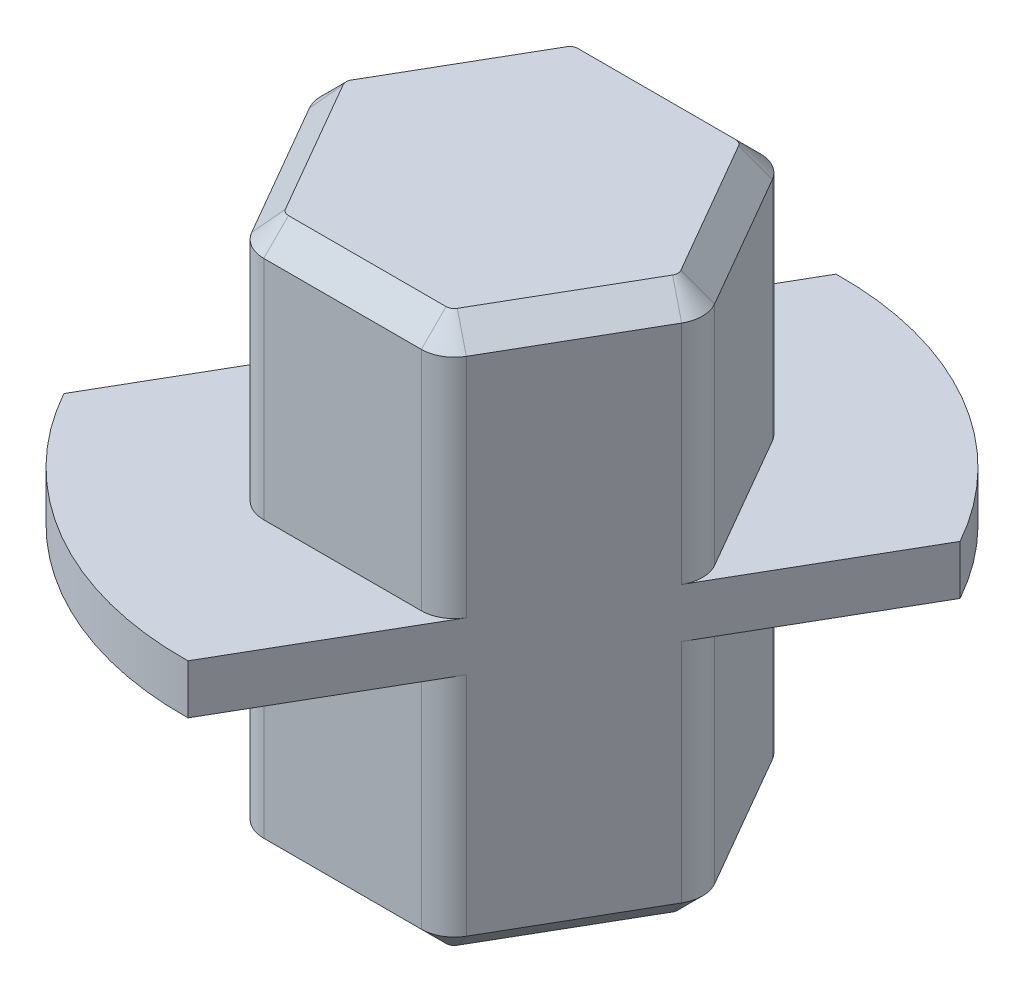
from build123d import *

# Parameters (mm, degrees)
BOSS_EXTRUDE1_DEPTH = 15.24
SKETCH2_R           = 20
BOSS_EXTRUDE2_DEPTH = 3
BOSS_EXTRUDE3_START = 18.24
BOSS_EXTRUDE3_DEPTH = 15.24
FILLET1_R           = 2
SKETCH3_W           = 35.8896148
SKETCH3_H           = 21.37412809
CUT_EXTRUDE1_DEPTH  = 51.878317112
CHAMFER2_SIZE       = 1.5
SKETCH5_W           = 51.439810339
SKETCH5_H           = 15.927026311
CUT_EXTRUDE3_DEPTH  = 50.49162642


with BuildPart() as part:
    # Sketch1 → Boss-Extrude1 (new body)
    with BuildSketch(Plane(origin=(0, 0, 0), x_dir=(1, 0, 0), z_dir=(0, 1, 0))):
        Polygon((5.9375, 10.28405167), (-5.9375, 10.28405167), (-11.875, 0), (-5.9375, -10.28405167), (5.9375, -10.28405167), (11.875, 0), align=None)
    extrude(amount=BOSS_EXTRUDE1_DEPTH)

    # Sketch2 → Boss-Extrude2 (add)
    with BuildSketch(Plane(origin=(0, 15.24, 0), x_dir=(1, 0, 0), z_dir=(0, 1, 0))):
        with Locations(Location((0, 0, 0), (0, 0, 270))):
            Circle(SKETCH2_R)
    extrude(amount=BOSS_EXTRUDE2_DEPTH)

    # Sketch1<2> → Boss-Extrude3 (add)
    with BuildSketch(Plane(origin=(0, 0, 0), x_dir=(1, 0, 0), z_dir=(0, 1, 0)).offset(BOSS_EXTRUDE3_START)):
        Polygon((5.9375, 10.28405167), (-5.9375, 10.28405167), (-11.875, 0), (-5.9375, -10.28405167), (5.9375, -10.28405167), (11.875, 0), align=None)
    extrude(amount=BOSS_EXTRUDE3_DEPTH)

    # Fillet1
    fillet1_edges = [part.edges().sort_by_distance(p)[0] for p in [
        (11.875, 7.62, 0),
        (5.9375, 7.62, 10.28405167),
        (-5.9375, 7.62, 10.28405167),
        (-11.875, 7.62, 0),
        (-5.9375, 7.62, -10.28405167),
        (5.9375, 7.62, -10.28405167),
        (-5.9375, 25.86, 10.28405167),
        (5.9375, 25.86, 10.28405167),
        (11.875, 25.86, 0),
        (5.9375, 25.86, -10.28405167),
        (-5.9375, 25.86, -10.28405167),
        (-11.875, 25.86, 0),
    ]]
    fillet(fillet1_edges, radius=FILLET1_R)

    # Sketch3 → Cut-Extrude1 (cut, through all)
    with BuildSketch(Plane(origin=(-8.90625, 0, -5.142025835), x_dir=(-0.5000000000000004, 0, 0.8660254037844385), z_dir=(-0.8660254037844384, 0, -0.5000000000000003))):
        with Locations((0.576480633, 22.756432149)):
            Rectangle(SKETCH3_W, SKETCH3_H)
    extrude(amount=CUT_EXTRUDE1_DEPTH, mode=Mode.SUBTRACT)

    # Chamfer2
    chamfer2_edges = [part.edges().sort_by_distance(p)[0] for p in [
        (0, 0, -10.28405167),
        (8.90625, 0, -5.142025835),
        (8.90625, 0, 5.142025835),
        (0, 0, 10.28405167),
        (-8.90625, 0, 5.142025835),
        (-8.90625, 0, -5.142025835),
        (11.565598923, 0, 0),
        (5.782799462, 0, 10.016102478),
        (-5.782799462, 0, 10.016102478),
        (-11.565598923, 0, 0),
        (-5.782799462, 0, -10.016102478),
        (5.782799462, 0, -10.016102478),
        (0, 33.48, -10.28405167),
        (8.90625, 33.48, -5.142025835),
        (0, 33.48, 10.28405167),
        (8.90625, 33.48, 5.142025835),
        (-8.90625, 33.48, -5.142025835),
        (-8.90625, 33.48, 5.142025835),
        (11.565598923, 33.48, 0),
        (5.782799462, 33.48, 10.016102478),
        (-5.782799462, 33.48, 10.016102478),
        (-11.565598923, 33.48, 0),
        (-5.782799462, 33.48, -10.016102478),
        (5.782799462, 33.48, -10.016102478),
    ]]
    chamfer(chamfer2_edges, length=CHAMFER2_SIZE)

    # Sketch5 → Cut-Extrude3 (cut, through all)
    with BuildSketch(Plane(origin=(8.90625, 0, 5.142025835), x_dir=(0.5000000000000004, 0, -0.8660254037844384), z_dir=(0.8660254037844384, 0, 0.5000000000000004))):
        with Locations((-1.041050082, 20.809011755)):
            Rectangle(SKETCH5_W, SKETCH5_H)
    extrude(amount=CUT_EXTRUDE3_DEPTH, mode=Mode.SUBTRACT)


solid = part.part
